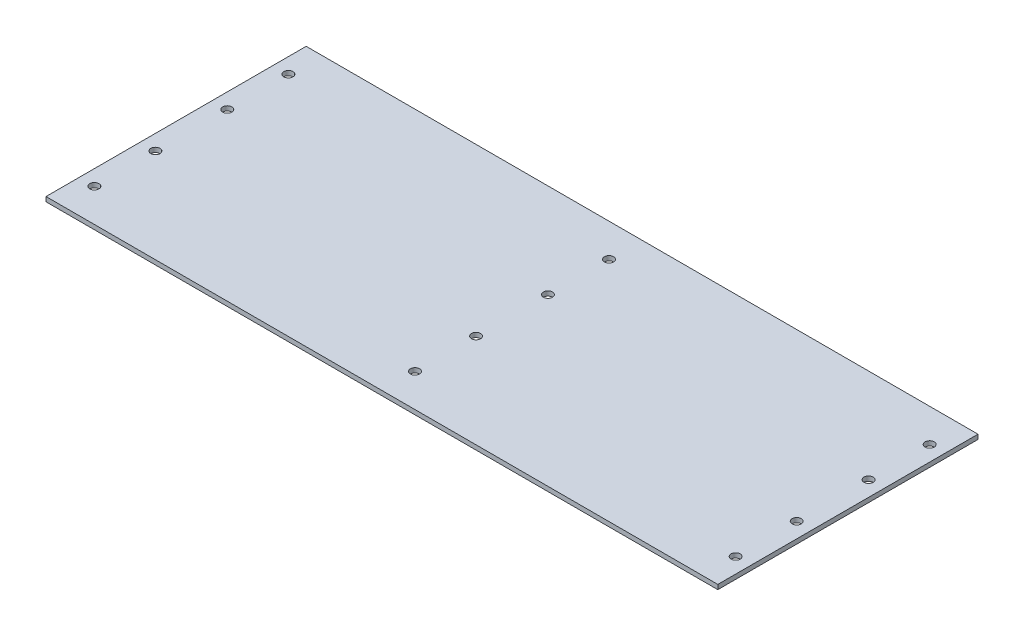
from build123d import *

# Parameters (mm, degrees)
SKETCH_1_W          = 220
SKETCH_1_H          = 85.2
EXTRUDE_1_DEPTH     = 1.5
SKETCH_2_R          = 1.5
CUT_EXTRUDE_1_DEPTH = 10


with BuildPart() as part:
    # 草图1 → 凸台-拉伸1 (new body)
    with BuildSketch(Plane(origin=(0, 0, 0), x_dir=(1, 0, 0), z_dir=(0, 1, 0))):
        with Locations((44.295012832, 1.717252595)):
            Rectangle(SKETCH_1_W, SKETCH_1_H)
    extrude(amount=EXTRUDE_1_DEPTH)

    # 草图2 → 切除-拉伸1 (cut)
    with BuildSketch(Plane(origin=(0, 1.5, 0), x_dir=(1, 0, 0), z_dir=(0, 1, 0))):
        with Locations(Location((149.295012832, -30.052747405, 0), (0, 0, 270))):
            Circle(SKETCH_2_R)
        with Locations(Location((149.295012832, -10.052747405, 0), (0, 0, 270))):
            Circle(SKETCH_2_R)
        with Locations(Location((44.295012832, -10.052747405, 0), (0, 0, 270))):
            Circle(SKETCH_2_R)
        with Locations(Location((44.295012832, -30.052747405, 0), (0, 0, 270))):
            Circle(SKETCH_2_R)
        with Locations(Location((44.295012832, 13.487252595, 0), (0, 0, 270))):
            Circle(SKETCH_2_R)
        with Locations(Location((44.295012832, 33.487252595, 0), (0, 0, 270))):
            Circle(SKETCH_2_R)
        with Locations(Location((149.295012832, 13.487252595, 0), (0, 0, 270))):
            Circle(SKETCH_2_R)
        with Locations(Location((149.295012832, 33.487252595, 0), (0, 0, 270))):
            Circle(SKETCH_2_R)
        with Locations(Location((-60.704987168, 33.487252595, 0), (0, 0, 270))):
            Circle(SKETCH_2_R)
        with Locations(Location((-60.704987168, 13.487252595, 0), (0, 0, 270))):
            Circle(SKETCH_2_R)
        with Locations(Location((-60.704987168, -10.052747405, 0), (0, 0, 270))):
            Circle(SKETCH_2_R)
        with Locations(Location((-60.704987168, -30.052747405, 0), (0, 0, 270))):
            Circle(SKETCH_2_R)
    extrude(amount=-CUT_EXTRUDE_1_DEPTH, mode=Mode.SUBTRACT)


solid = part.part
